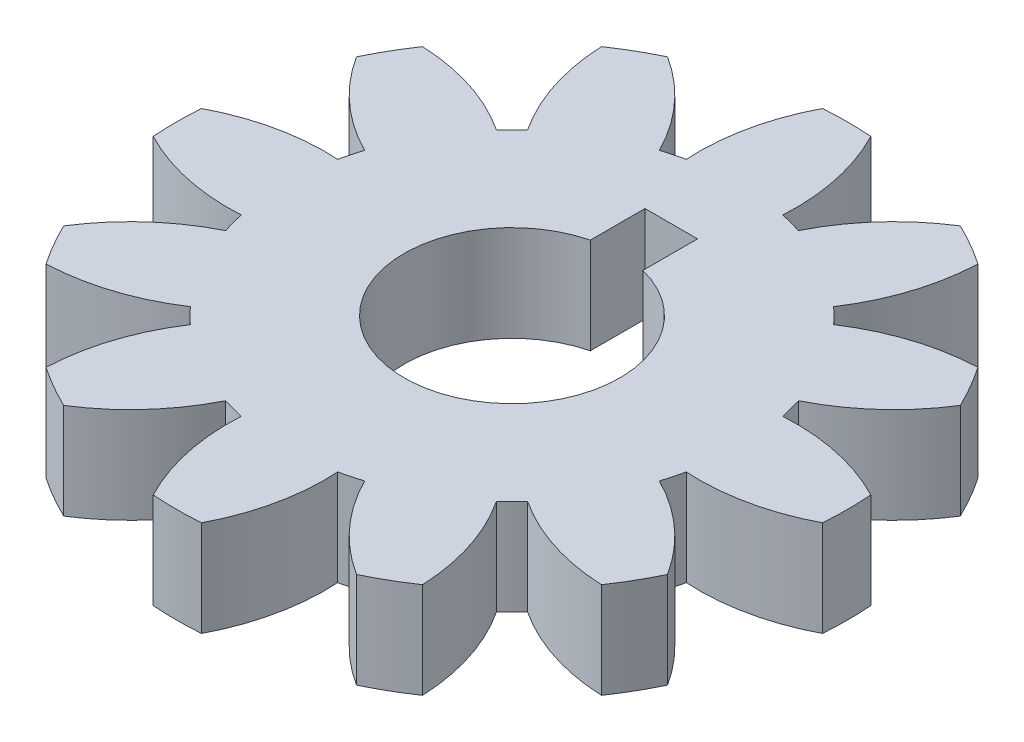
from build123d import *

# Parameters (mm, degrees)
EXTRUDE_1_DEPTH     = 4
CUT_EXTRUDE_1_DEPTH = 4


with BuildPart() as part:
    # 草图1 → 凸台-拉伸1 (new body)
    with BuildSketch(Plane(origin=(0, 0, 0), x_dir=(1, 0, 0), z_dir=(0, 1, 0))):
        with BuildLine():
            ThreePointArc((1.007141152, 13.96372682), (0, 14), (-1.007141152, 13.96372682))
            ThreePointArc((-1.007141152, 13.96372682), (-1.829065946, 11.692687307), (-2.012232645, 9.284445044))
            ThreePointArc((-2.012232645, 9.284445044), (-2.458780928, 9.17629535), (-2.899577934, 9.046681591))
            ThreePointArc((-2.899577934, 9.046681591), (-4.262326079, 11.04069722), (-6.109653587, 12.596512734))
            ThreePointArc((-6.109653587, 12.596512734), (-7, 12.124355653), (-7.854073233, 11.589371581))
            ThreePointArc((-7.854073233, 11.589371581), (-7.430361228, 9.211631273), (-6.384867111, 7.034448946))
            ThreePointArc((-6.384867111, 7.034448946), (-6.717514421, 6.717514421), (-7.034448946, 6.384867111))
            ThreePointArc((-7.034448946, 6.384867111), (-9.211631273, 7.430361228), (-11.589371581, 7.854073233))
            ThreePointArc((-11.589371581, 7.854073233), (-12.124355653, 7), (-12.596512734, 6.109653587))
            ThreePointArc((-12.596512734, 6.109653587), (-11.04069722, 4.262326079), (-9.046681591, 2.899577934))
            ThreePointArc((-9.046681591, 2.899577934), (-9.17629535, 2.458780928), (-9.284445044, 2.012232645))
            ThreePointArc((-9.284445044, 2.012232645), (-11.692687307, 1.829065946), (-13.96372682, 1.007141152))
            ThreePointArc((-13.96372682, 1.007141152), (-14, 0), (-13.96372682, -1.007141152))
            ThreePointArc((-13.96372682, -1.007141152), (-11.692687307, -1.829065946), (-9.284445044, -2.012232645))
            ThreePointArc((-9.284445044, -2.012232645), (-9.17629535, -2.458780928), (-9.046681591, -2.899577934))
            ThreePointArc((-9.046681591, -2.899577934), (-11.04069722, -4.262326079), (-12.596512734, -6.109653587))
            ThreePointArc((-12.596512734, -6.109653587), (-12.124355653, -7), (-11.589371581, -7.854073233))
            ThreePointArc((-11.589371581, -7.854073233), (-9.211631273, -7.430361228), (-7.034448946, -6.384867111))
            ThreePointArc((-7.034448946, -6.384867111), (-6.717514421, -6.717514421), (-6.384867111, -7.034448946))
            ThreePointArc((-6.384867111, -7.034448946), (-7.430361228, -9.211631273), (-7.854073233, -11.589371581))
            ThreePointArc((-7.854073233, -11.589371581), (-7, -12.124355653), (-6.109653587, -12.596512734))
            ThreePointArc((-6.109653587, -12.596512734), (-4.262326079, -11.04069722), (-2.899577934, -9.046681591))
            ThreePointArc((-2.899577934, -9.046681591), (-2.458780928, -9.17629535), (-2.012232645, -9.284445044))
            ThreePointArc((-2.012232645, -9.284445044), (-1.829065946, -11.692687307), (-1.007141152, -13.96372682))
            ThreePointArc((-1.007141152, -13.96372682), (0, -14), (1.007141152, -13.96372682))
            ThreePointArc((1.007141152, -13.96372682), (1.829065946, -11.692687307), (2.012232645, -9.284445044))
            ThreePointArc((2.012232645, -9.284445044), (2.458780928, -9.17629535), (2.899577934, -9.046681591))
            ThreePointArc((2.899577934, -9.046681591), (4.262326079, -11.04069722), (6.109653587, -12.596512734))
            ThreePointArc((6.109653587, -12.596512734), (7, -12.124355653), (7.854073233, -11.589371581))
            ThreePointArc((7.854073233, -11.589371581), (7.430361228, -9.211631273), (6.384867111, -7.034448946))
            ThreePointArc((6.384867111, -7.034448946), (6.717514421, -6.717514421), (7.034448946, -6.384867111))
            ThreePointArc((7.034448946, -6.384867111), (9.211631273, -7.430361228), (11.589371581, -7.854073233))
            ThreePointArc((11.589371581, -7.854073233), (12.124355653, -7), (12.596512734, -6.109653587))
            ThreePointArc((12.596512734, -6.109653587), (11.04069722, -4.262326079), (9.046681591, -2.899577934))
            ThreePointArc((9.046681591, -2.899577934), (9.17629535, -2.458780928), (9.284445044, -2.012232645))
            ThreePointArc((9.284445044, -2.012232645), (11.692687307, -1.829065946), (13.96372682, -1.007141152))
            ThreePointArc((13.96372682, -1.007141152), (14, 0), (13.96372682, 1.007141152))
            ThreePointArc((13.96372682, 1.007141152), (11.692687307, 1.829065946), (9.284445044, 2.012232645))
            ThreePointArc((9.284445044, 2.012232645), (9.17629535, 2.458780928), (9.046681591, 2.899577934))
            ThreePointArc((9.046681591, 2.899577934), (11.04069722, 4.262326079), (12.596512734, 6.109653587))
            ThreePointArc((12.596512734, 6.109653587), (12.124355653, 7), (11.589371581, 7.854073233))
            ThreePointArc((11.589371581, 7.854073233), (9.211631273, 7.430361228), (7.034448946, 6.384867111))
            ThreePointArc((7.034448946, 6.384867111), (6.717514421, 6.717514421), (6.384867111, 7.034448946))
            ThreePointArc((6.384867111, 7.034448946), (7.430361228, 9.211631273), (7.854073233, 11.589371581))
            ThreePointArc((7.854073233, 11.589371581), (7, 12.124355653), (6.109653587, 12.596512734))
            ThreePointArc((6.109653587, 12.596512734), (4.262326079, 11.04069722), (2.899577934, 9.046681591))
            ThreePointArc((2.899577934, 9.046681591), (2.458780928, 9.17629535), (2.012232645, 9.284445044))
            ThreePointArc((2.012232645, 9.284445044), (1.829065946, 11.692687307), (1.007141152, 13.96372682))
        make_face()
    extrude(amount=EXTRUDE_1_DEPTH)

    # 草图2 → 切除-拉伸1 (cut)
    with BuildSketch(Plane(origin=(0, 4, 0), x_dir=(1, 0, 0), z_dir=(0, 1, 0))):
        with BuildLine():
            Line((-1.095859036, 4.364526661), (-1.095859036, 6.645001166))
            Line((-1.095859036, 6.645001166), (1.095859036, 6.645001166))
            Line((1.095859036, 6.645001166), (1.095859036, 4.364526661))
            ThreePointArc((1.095859036, 4.364526661), (0, -4.5), (-1.095859036, 4.364526661))
        make_face()
    extrude(amount=-CUT_EXTRUDE_1_DEPTH, mode=Mode.SUBTRACT)


solid = part.part
